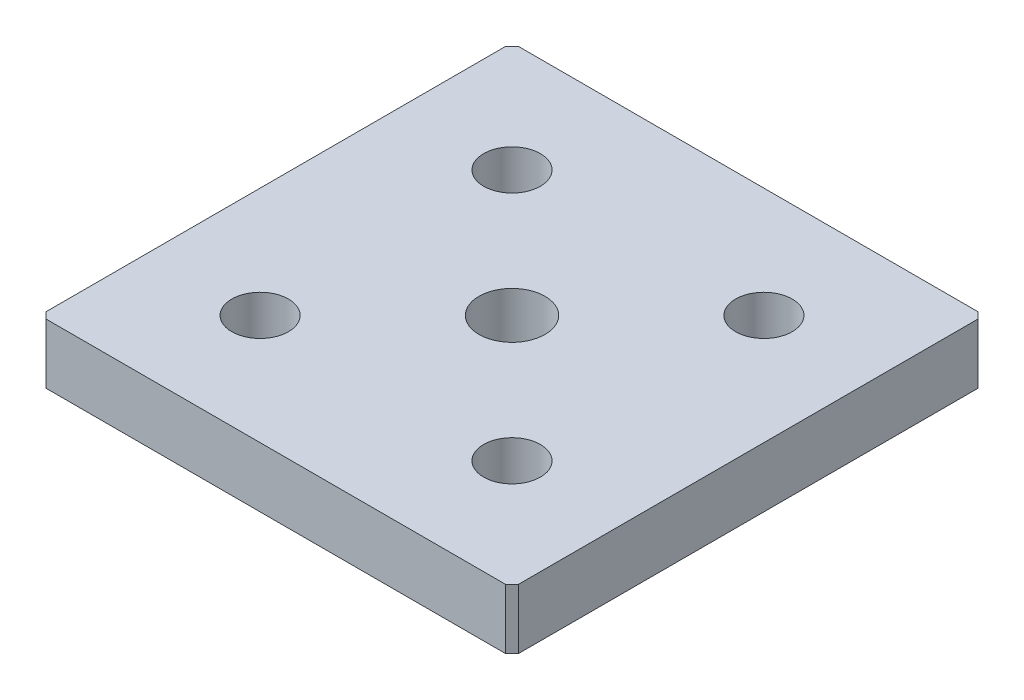
from build123d import *

# Parameters (mm, degrees)
SKETCH1_W              = 75
SKETCH1_H              = 75
BOSS_EXTRUDE1_DEPTH    = 4.7625
M8_CLEARANCE_HOLE1_D   = 9
M12X1_5_TAPPED_HOLE1_D = 10.5
CHAMFER1_SIZE          = 1


with BuildPart() as part:
    # Sketch1 → Boss-Extrude1 (new, symmetric)
    with BuildSketch(Plane(origin=(0, 0, 0), x_dir=(1, 0, 0), z_dir=(0, 1, 0))):
        Rectangle(SKETCH1_W, SKETCH1_H)
    extrude(amount=BOSS_EXTRUDE1_DEPTH, both=True)

    # M8 Clearance Hole1 (through all)
    with Locations(Plane(origin=(0, 4.7625, 0), x_dir=(1, 0, 0), z_dir=(0, 1, 0))):
        with Locations((-20, 20), (20, 20), (-20, -20), (20, -20)):
            Hole(M8_CLEARANCE_HOLE1_D / 2)

    # M12x1.5 Tapped Hole1 (through all)
    with Locations(Plane(origin=(0, 4.7625, 0), x_dir=(1, 0, 0), z_dir=(0, 1, 0))):
        with Locations((0, 0)):
            Hole(M12X1_5_TAPPED_HOLE1_D / 2)

    # Chamfer1
    chamfer1_edges = [part.edges().sort_by_distance(p)[0] for p in [
        (37.5, 0, 37.5),
        (-37.5, 0, 37.5),
        (-37.5, 0, -37.5),
        (37.5, 0, -37.5),
    ]]
    chamfer(chamfer1_edges, length=CHAMFER1_SIZE)


solid = part.part
